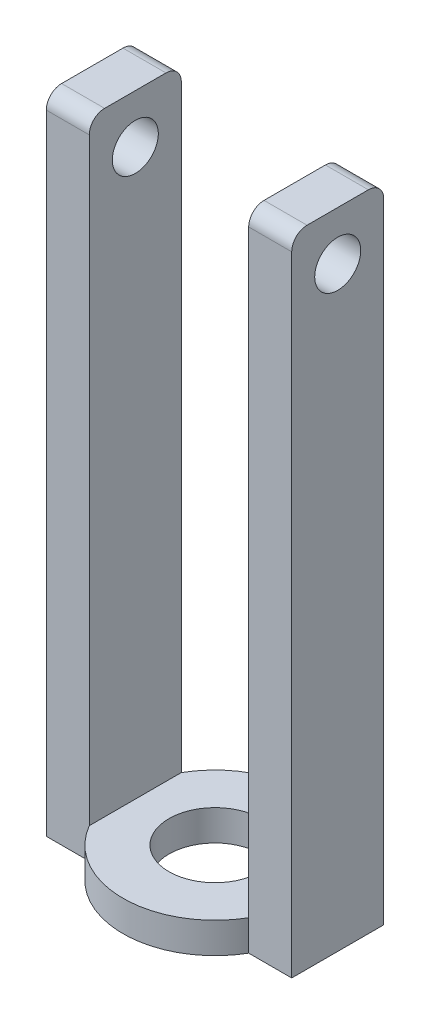
from build123d import *

# Parameters (mm, degrees)
BOSS_EXTRUDE1_DEPTH = 100
SKETCH2_W           = 140.192378865
SKETCH2_H           = 300
BOSS_EXTRUDE2_DEPTH = 2000
SKETCH3_R           = 150
CUT_EXTRUDE1_DEPTH  = 100
FILLET1_R           = 50
CUT_EXTRUDE2_START  = -800
SKETCH4_R           = 75
CUT_EXTRUDE2_DEPTH  = 800


with BuildPart() as part:
    # Sketch1 → Boss-Extrude1 (new body)
    with BuildSketch(Plane(origin=(0, 0, 0), x_dir=(1, 0, 0), z_dir=(0, 1, 0))):
        with BuildLine():
            ThreePointArc((259.807621135, 150), (0, 300), (-259.807621135, 150))
            Line((-259.807621135, 150), (259.807621135, 150))
        make_face()
        with BuildLine():
            Line((259.807621135, 150), (-259.807621135, 150))
            ThreePointArc((-259.807621135, 150), (-300, 0), (-259.807621135, -150))
            Line((-259.807621135, -150), (259.807621135, -150))
            ThreePointArc((259.807621135, -150), (289.777747887, -77.645713531), (300, 0))
            ThreePointArc((300, 0), (289.777747887, 77.645713531), (259.807621135, 150))
        make_face()
        with BuildLine():
            Line((259.807621135, -150), (-259.807621135, -150))
            ThreePointArc((-259.807621135, -150), (0, -300), (259.807621135, -150))
        make_face()
        with BuildLine():
            Line((-259.807621135, 150), (-400, 150))
            Line((-400, 150), (-400, -150))
            Line((-400, -150), (-259.807621135, -150))
            ThreePointArc((-259.807621135, -150), (-300, 0), (-259.807621135, 150))
        make_face()
        with BuildLine():
            Line((400, 150), (259.807621135, 150))
            ThreePointArc((259.807621135, 150), (289.777747887, 77.645713531), (300, 0))
            ThreePointArc((300, 0), (289.777747887, -77.645713531), (259.807621135, -150))
            Line((259.807621135, -150), (400, -150))
            Line((400, -150), (400, 150))
        make_face()
    extrude(amount=BOSS_EXTRUDE1_DEPTH)

    # Sketch2 → Boss-Extrude2 (add)
    with BuildSketch(Plane(origin=(0, 100, 0), x_dir=(1, 0, 0), z_dir=(0, 1, 0))):
        with Locations((-329.903810568, 0)):
            Rectangle(SKETCH2_W, SKETCH2_H)
        with Locations((329.903810568, 0)):
            Rectangle(SKETCH2_W, SKETCH2_H)
    extrude(amount=BOSS_EXTRUDE2_DEPTH)

    # Sketch3 → Cut-Extrude1 (cut)
    with BuildSketch(Plane(origin=(0, 100, 0), x_dir=(1, 0, 0), z_dir=(0, 1, 0))):
        with Locations(Location((0, 0, 0), (0, 0, 270))):
            Circle(SKETCH3_R)
    extrude(amount=-CUT_EXTRUDE1_DEPTH, mode=Mode.SUBTRACT)

    # Fillet1
    fillet1_edges = [part.edges().sort_by_distance(p)[0] for p in [
        (-329.903810568, 2100, -150),
        (-329.903810568, 2100, 150),
        (329.903810568, 2100, -150),
        (329.903810568, 2100, 150),
    ]]
    fillet(fillet1_edges, radius=FILLET1_R)

    # Sketch4 → Cut-Extrude2 (cut)
    with BuildSketch(Plane.ZY.offset(400).offset(CUT_EXTRUDE2_START)):
        with Locations((0, 1941.16)):
            Circle(SKETCH4_R)
    extrude(amount=CUT_EXTRUDE2_DEPTH, mode=Mode.SUBTRACT)


solid = part.part
